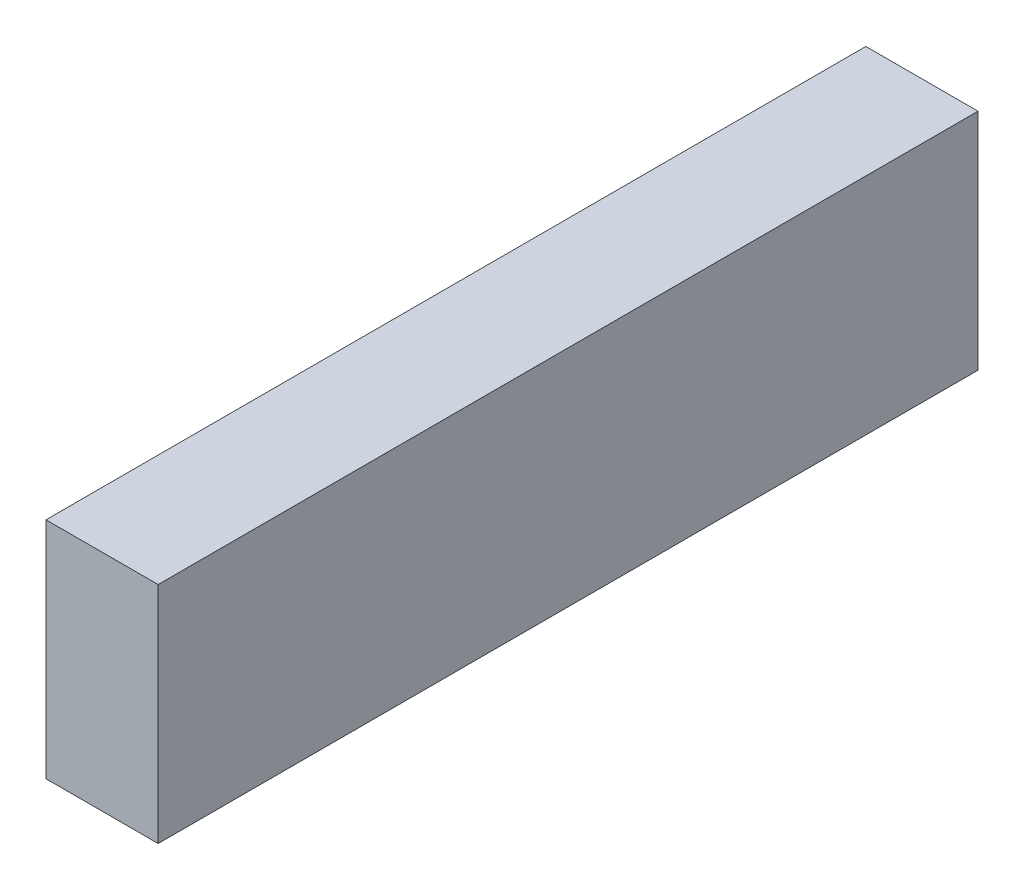
from build123d import *

# Parameters (mm, degrees)
SKETCH1_W           = 73.1
SKETCH1_H           = 20
BOSS_EXTRUDE1_DEPTH = 10


with BuildPart() as part:
    # Sketch1 → Boss-Extrude1 (new body)
    with BuildSketch(Plane(origin=(0, 0, 0), x_dir=(0, 0, -1), z_dir=(1, 0, 0))):
        with Locations((36.55, 10)):
            Rectangle(SKETCH1_W, SKETCH1_H)
    extrude(amount=-BOSS_EXTRUDE1_DEPTH)


solid = part.part
